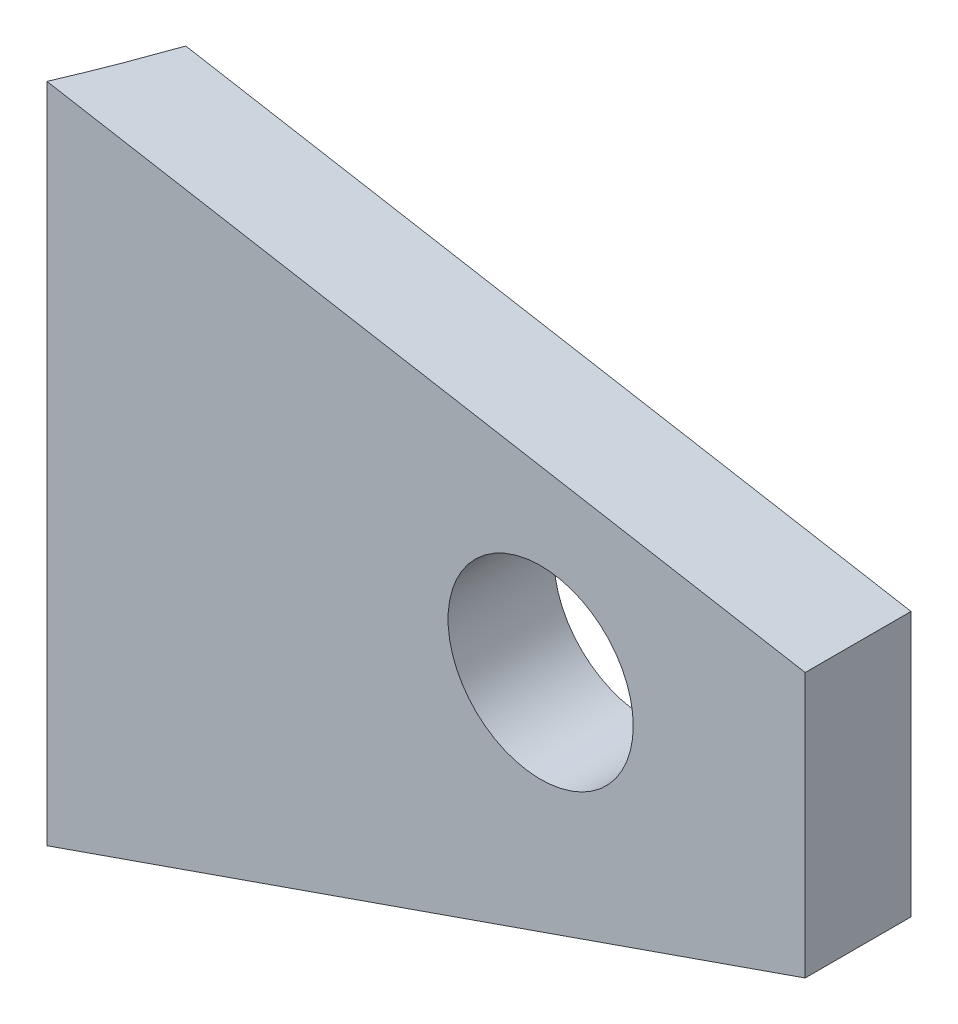
from build123d import *

# Parameters (mm, degrees)
SKETCH15_R              = 1.75
BOSS_EXTRUDE2_DEPTH     = 2
CUT_EXTRUDE1_DEPTH      = 13.136675822
CUT_EXTRUDE1_DEPTH_BACK = 13.136675822
SKETCH16_R              = 37


with BuildPart() as part:
    # Sketch15 → Boss-Extrude2 (new body)
    with BuildSketch(Plane.XY):
        Polygon((-9.33, 5.01), (-9.33, -7.5), (5, -2.5), (5, 2.5), align=None)
        Circle(SKETCH15_R, mode=Mode.SUBTRACT)
    extrude(amount=BOSS_EXTRUDE2_DEPTH)

    # Sketch16 → Cut-Extrude1 (cut, two sides: drawn at the far end of the back side and taken through both)
    with BuildSketch(Plane(origin=(0, 0, 0), x_dir=(1, 0, 0), z_dir=(0, 1, 0)).offset(-CUT_EXTRUDE1_DEPTH_BACK)):
        with Locations((-44.33, 10)):
            Circle(SKETCH16_R)
    extrude(amount=CUT_EXTRUDE1_DEPTH + CUT_EXTRUDE1_DEPTH_BACK, mode=Mode.SUBTRACT)


solid = part.part
